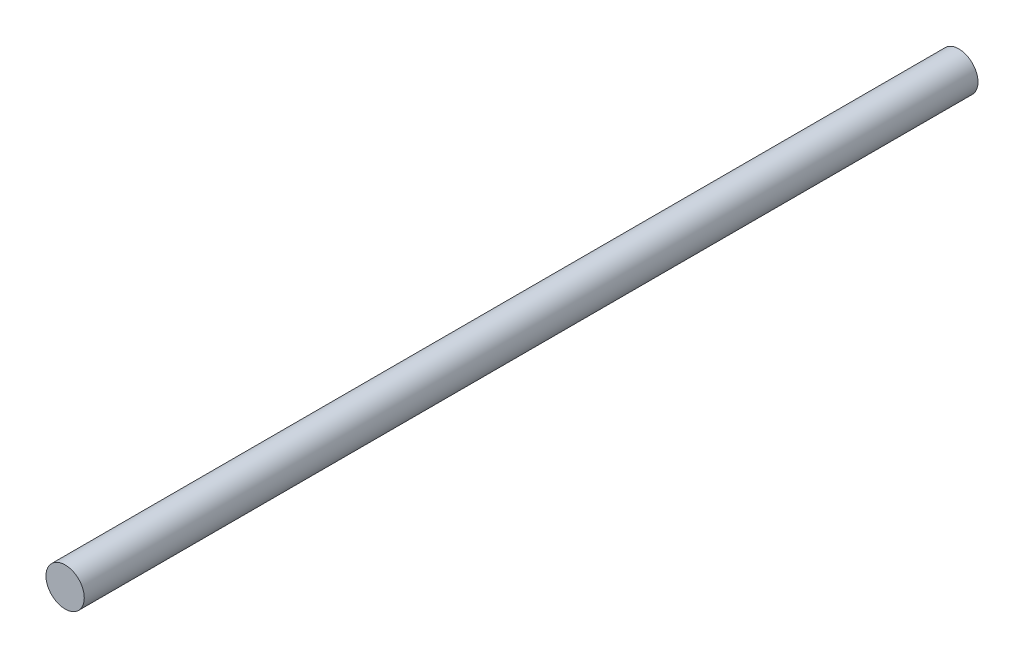
from build123d import *

# Parameters (mm, degrees)
SKETCH1_R           = 7.5
BOSS_EXTRUDE2_DEPTH = 350


with BuildPart() as part:
    # Sketch1 → Boss-Extrude2 (new body)
    with BuildSketch(Plane.XY):
        Circle(SKETCH1_R)
    extrude(amount=-BOSS_EXTRUDE2_DEPTH)


solid = part.part
